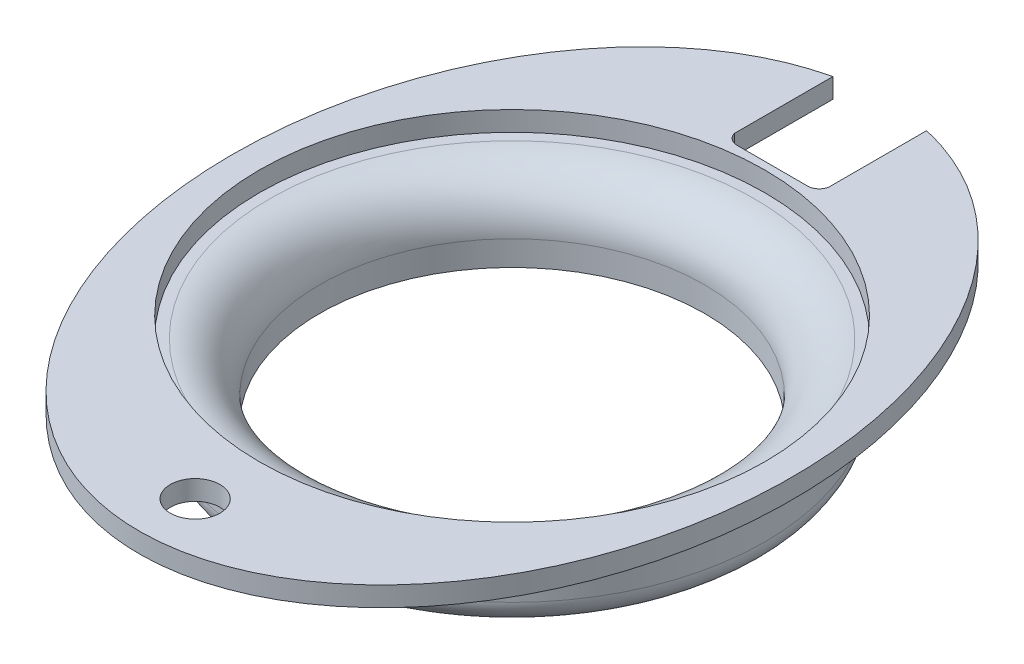
from build123d import *

# Parameters (mm, degrees)
SKETCH2_R               = 20.335
BOSS_EXTRUDE1_DEPTH     = 1.5875
SKETCH2_4_R             = 20.335
BOSS_EXTRUDE2_DEPTH     = 6
SKETCH3_R               = 15.5
CUT_EXTRUDE1_DEPTH      = 6
FILLET2_R               = 4
FILLET3_R               = 2
CUT_EXTRUDE2_DEPTH      = 39.259902859
CUT_EXTRUDE2_DEPTH_BACK = 39.259902859
SKETCH4_R               = 2


with BuildPart() as part:
    # Sketch2 → Boss-Extrude1 (new body)
    with BuildSketch(Plane(origin=(0, 0, 0), x_dir=(1, 0, 0), z_dir=(0, 1, 0))):
        with BuildLine():
            Line((-3.771138016, 21.675595911), (-3.771138016, 29.575621134))
            add(Edge.make_bspline(
                [(-3.771138016, 29.575621134), (-37.647416572, 21.896496414), (-18.823708286, -16.434003035), (0, -54.764502483), (18.823708286, -16.434003035), (37.647416572, 21.896496414), (3.771138016, 29.575621134)],
                knots=[3.309993603, 3.309993603, 3.309993603, 5.292121406, 5.292121406, 7.274249208, 7.274249208, 9.256377011, 9.256377011, 9.256377011], degree=2, weights=[1, 0.547800101, 1, 0.547800101, 1, 0.547800101, 1]))
            Line((3.771138016, 29.575621134), (3.771138016, 21.675595911))
            ThreePointArc((3.771138016, 21.675595911), (3.433198339, 21.140888968), (2.835965916, 20.932494697))
            Line((2.835965916, 20.932494697), (-2.664034084, 20.932494697))
            Line((-2.664034084, 20.932494697), (-2.835965916, 20.932494697))
            ThreePointArc((-2.835965916, 20.932494697), (-3.433198339, 21.140888968), (-3.771138016, 21.675595911))
        make_face()
        Circle(SKETCH2_R, mode=Mode.SUBTRACT)
    extrude(amount=BOSS_EXTRUDE1_DEPTH)

    # Sketch4 → Cut-Extrude2 (cut, two sides: drawn at the far end of the back side and taken through both)
    with BuildSketch(Plane(origin=(0, 1.5875, 0), x_dir=(1, 0, 0), z_dir=(0, 1, 0)).offset(-CUT_EXTRUDE2_DEPTH_BACK)):
        with Locations((0, -25.5)):
            Circle(SKETCH4_R)
    extrude(amount=CUT_EXTRUDE2_DEPTH + CUT_EXTRUDE2_DEPTH_BACK, mode=Mode.SUBTRACT)


with BuildPart() as body_2:
    # Sketch2<4> → Boss-Extrude2 (new body)
    with BuildSketch(Plane(origin=(0, 0, 0), x_dir=(1, 0, 0), z_dir=(0, 1, 0))):
        Circle(SKETCH2_4_R)
    extrude(amount=-BOSS_EXTRUDE2_DEPTH)

    # Sketch3 → Cut-Extrude1 (cut)
    with BuildSketch(Plane(origin=(0, 0, 0), x_dir=(1, 0, 0), z_dir=(0, 1, 0))):
        Circle(SKETCH3_R)
    extrude(amount=-CUT_EXTRUDE1_DEPTH, mode=Mode.SUBTRACT)

    # Fillet2
    fillet2_edges = [body_2.edges().sort_by_distance(p)[0] for p in [
        (-15.5, 0, 0),
    ]]
    fillet(fillet2_edges, radius=FILLET2_R)

    # Fillet3
    fillet3_edges = [body_2.edges().sort_by_distance(p)[0] for p in [
        (-20.335, -6, 0),
    ]]
    fillet(fillet3_edges, radius=FILLET3_R)


solid = Compound([part.part, body_2.part])
